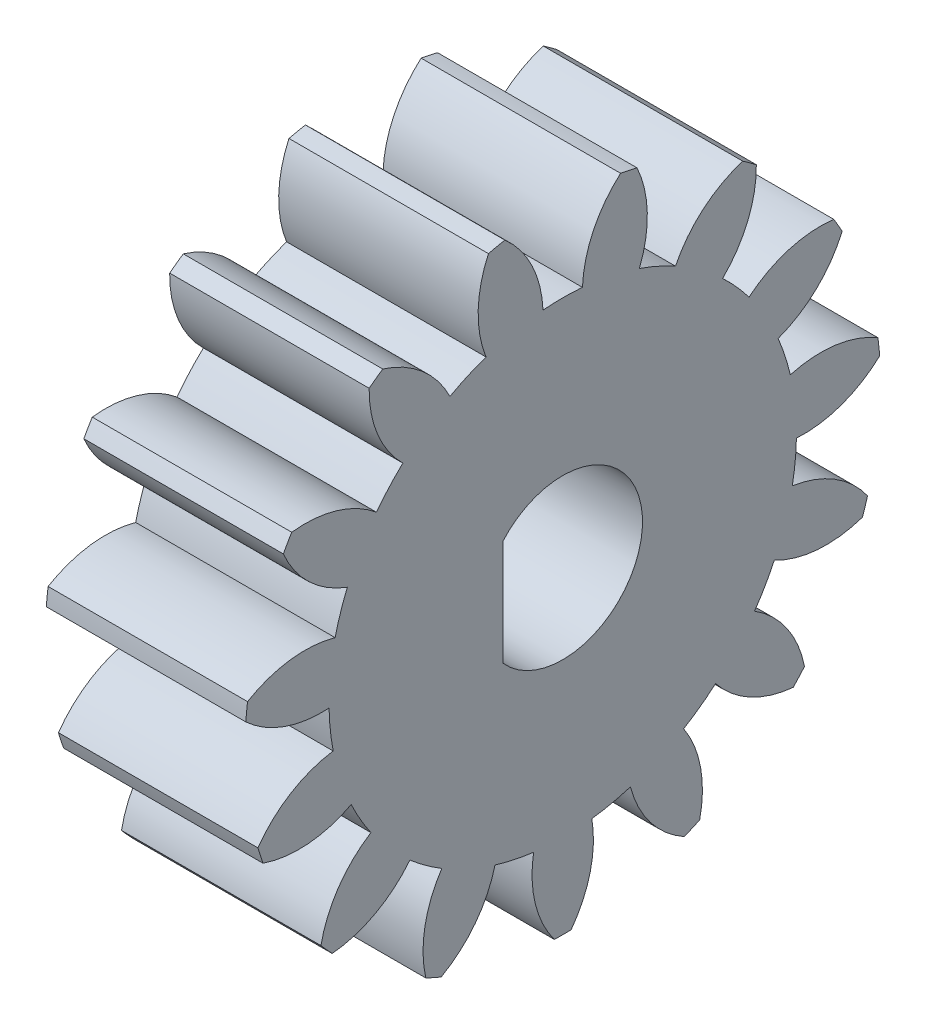
from build123d import *

# Parameters (mm, degrees)
BASPROSKE_W         = 8
BASPROSKE_H         = 12.75
TOOTHCUT_DEPTH      = 20.726251545
TEETHCUTS_COUNT     = 15
TEETHCUTS_ANGLE     = 336
BORSKE_R            = 3
BORE_DEPTH          = 50.0000508
SKETCH2_R           = 3.2
CUT_EXTRUDE1_DEPTH  = 20.701035813
BOSS_EXTRUDE1_DEPTH = 8


with BuildPart() as part:
    # BasProSke → Base-Revolve (revolve)
    with BuildSketch(Plane(origin=(0, 0, 0), x_dir=(1, 0, 0), z_dir=(0, 1, 0)), mode=Mode.PRIVATE) as base_revolve_sk:
        with Locations((4, 6.375)):
            Rectangle(BASPROSKE_W, BASPROSKE_H)
    revolve(base_revolve_sk.sketch.rotate(Axis((-10, 0, 0), (1, 0, 0)), 180), axis=Axis((-10, 0, 0), (1, 0, 0)))

    # TooCutSke → ToothCut (cut, through all)
    with BuildSketch(Plane(origin=(0, 0, 0), x_dir=(0, 0, -1), z_dir=(1, 0, 0))):
        with BuildLine():
            ThreePointArc((0.791546546, 9.340520867), (0, 9.374), (-0.791546546, 9.340520867))
            ThreePointArc((-0.791546546, 9.340520867), (-1.235070734, 11.110218102), (-2.344732916, 12.558386549))
            ThreePointArc((-2.344732916, 12.558386549), (0, 12.7754), (2.344732916, 12.558386549))
            ThreePointArc((2.344732916, 12.558386549), (1.235070734, 11.110218102), (0.791546546, 9.340520867))
        make_face()
    toothcut = extrude(amount=TOOTHCUT_DEPTH, mode=Mode.SUBTRACT)

    # TeethCuts: ToothCut ×15 about axis
    teethcuts_axis = Axis((-10, 0, 0), (1, 0, 0))
    for i in range(1, TEETHCUTS_COUNT):
        add(toothcut.rotate(teethcuts_axis, i * TEETHCUTS_ANGLE / (TEETHCUTS_COUNT - 1)), mode=Mode.SUBTRACT)

    # BorSke → Bore (cut, symmetric)
    with BuildSketch(Plane(origin=(0, 0, 0), x_dir=(0, 0, -1), z_dir=(1, 0, 0))):
        with Locations(Location((0, 0, 0), (0, 0, 180))):
            Circle(BORSKE_R)
    extrude(amount=BORE_DEPTH, both=True, mode=Mode.SUBTRACT)

    # Sketch2 → Cut-Extrude1 (cut, through all)
    with BuildSketch(Plane.ZY):
        Circle(SKETCH2_R)
    extrude(amount=-CUT_EXTRUDE1_DEPTH, mode=Mode.SUBTRACT)

    # Sketch3 → Boss-Extrude1 (add)
    with BuildSketch(Plane.ZY):
        with BuildLine():
            Line((2.4, 2.116601049), (2.4, -2.116601049))
            ThreePointArc((2.4, -2.116601049), (3.2, 0), (2.4, 2.116601049))
        make_face()
    extrude(amount=-BOSS_EXTRUDE1_DEPTH)


solid = part.part
